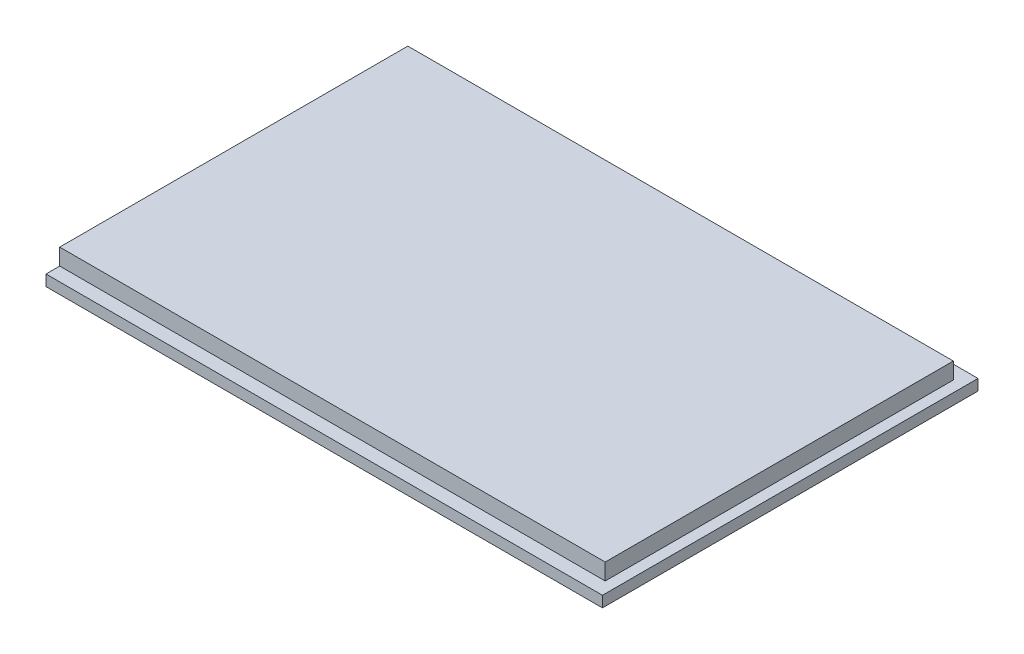
from build123d import *

# Parameters (mm, degrees)
SKETCH_2_W      = 40.6
SKETCH_2_H      = 27.4
EXTRUDE_1_DEPTH = 0.8
SKETCH_3_W      = 39.8
SKETCH_3_H      = 25.4
EXTRUDE_2_DEPTH = 1.2


with BuildPart() as part:
    # 草图2 → 凸台-拉伸1 (new body)
    with BuildSketch(Plane(origin=(0, 0, 0), x_dir=(1, 0, 0), z_dir=(0, 1, 0))):
        Rectangle(SKETCH_2_W, SKETCH_2_H)
    extrude(amount=EXTRUDE_1_DEPTH)

    # 草图3 → 凸台-拉伸2 (add)
    with BuildSketch(Plane(origin=(0, 0.8, 0), x_dir=(1, 0, 0), z_dir=(0, 1, 0))):
        with Locations((-0.4, 0)):
            Rectangle(SKETCH_3_W, SKETCH_3_H)
    extrude(amount=EXTRUDE_2_DEPTH)


solid = part.part
